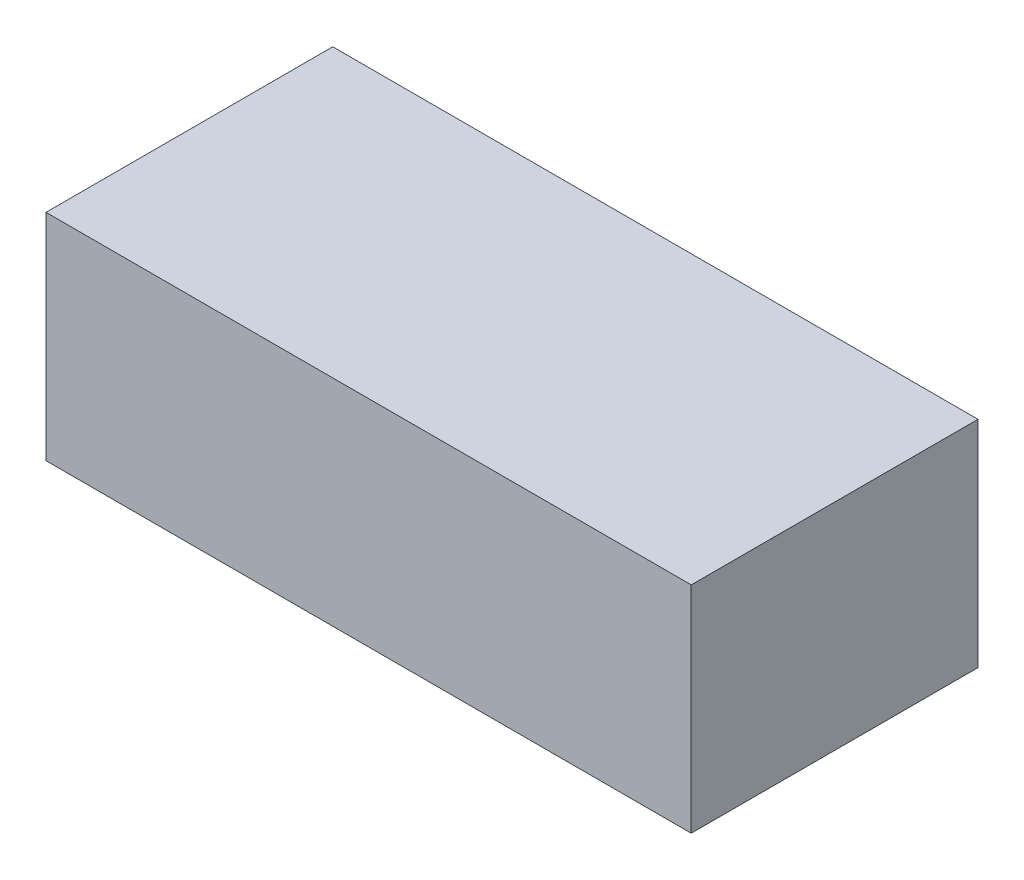
from build123d import *

# Parameters (mm, degrees)
SKETCH_1_W      = 18
SKETCH_1_H      = 8
EXTRUDE_1_DEPTH = 6


with BuildPart() as part:
    # 草图1 → 凸台-拉伸1 (new body)
    with BuildSketch(Plane(origin=(0, 0, 0), x_dir=(1, 0, 0), z_dir=(0, 1, 0))):
        Rectangle(SKETCH_1_W, SKETCH_1_H)
    extrude(amount=EXTRUDE_1_DEPTH)


solid = part.part
